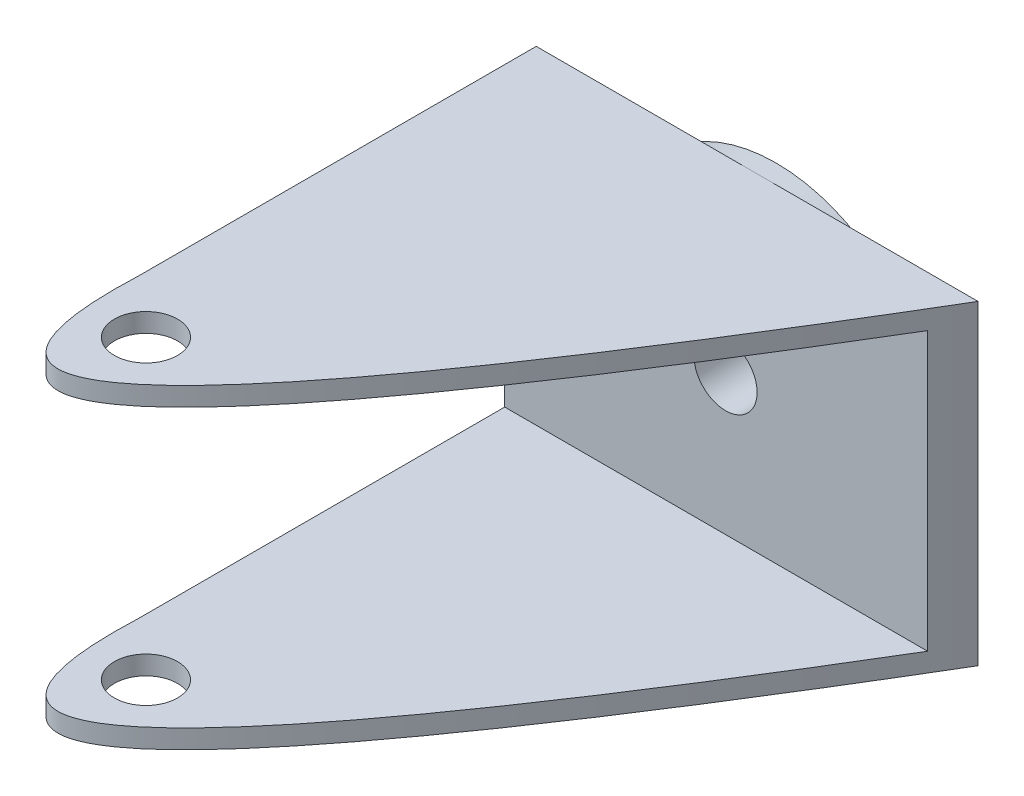
from build123d import *

# Parameters (mm, degrees)
EXTRUDE_1_DEPTH      = 50
SKETCH_2_R           = 4.999999999999998
CUT_EXTRUDE_1_DEPTH  = 98.87084830229739
SKETCH_3_R           = 15
EXTRUDE_2_DEPTH      = 3
CUT_EXTRUDE_3_REACH  = 108.899
SKETCH_5_R           = 5.000000000000001
SKETCH_6_R           = 5.0000000000000036
CUT_EXTRUDE_5_DEPTH  = 107.89919436089083
CUT_EXTRUDE_7_DEPTH  = 120.99999999999977
CUT_EXTRUDE_10_DEPTH = 10
SKETCH_9_R           = 25
SKETCH_9_R_2         = 15
EXTRUDE_3_DEPTH      = 3
SKETCH_10_R          = 5.0000000000000036
EXTRUDE_4_DEPTH      = 8
SKETCH_11_W          = 70
SKETCH_11_H          = 50.00000000000001
CUT_EXTRUDE_11_DEPTH = 8
SKETCH_12_R          = 25.000000000000004
EXTRUDE_6_DEPTH      = 3
CUT_EXTRUDE_14_DEPTH = 6.500000000000001
SCALE_1_SCALE        = 0.5
SCALE_2_SCALE        = 1.2


with BuildPart() as part:
    # 草图1 → 凸台-拉伸1 (new body)
    with BuildSketch(Plane(origin=(0, 0, 0), x_dir=(1, 0, 0), z_dir=(0, 1, 0))):
        with BuildLine():
            Line((-23.323422211177558, 7.232068902691513), (-23.323422211177558, 70))
            Line((-23.323422211177558, 70), (46.67657778882245, 70))
            add(Edge.make_bspline(
                [(46.67657778882245, 70), (-25.880344692728325, -52.054397164609135), (-23.323422211177558, 7.232068902691513)],
                knots=[0, 0, 0, 1, 1, 1], degree=2))
        make_face()
    extrude(amount=EXTRUDE_1_DEPTH)

    # 草图2 → 切除-拉伸1 (cut, through all)
    with BuildSketch(Plane(origin=(0, 50, 0), x_dir=(1, 0, 0), z_dir=(0, 1, 0))):
        with Locations(Location((-14.323422211177558, -0.8457019663808466, 0), (0, 0, 270))):
            Circle(SKETCH_2_R)
    extrude(amount=-CUT_EXTRUDE_1_DEPTH, mode=Mode.SUBTRACT)

    # 草图3 → 凸台-拉伸2 (add)
    with BuildSketch(Plane(origin=(0, 0, -70), x_dir=(-1, 0, 0), z_dir=(0, 0, -1))):
        with Locations(Location((-21.676577788822446, 25, 0), (0, 0, 180))):
            Circle(SKETCH_3_R)
    extrude(amount=EXTRUDE_2_DEPTH)

    # 草图5 → 切除-拉伸3 (cut, up to next)
    with BuildSketch(Plane(origin=(0, 0, -70), x_dir=(-1, 0, 0), z_dir=(0, 0, -1)), mode=Mode.PRIVATE) as cut_extrude_3_sk1:
        with Locations((-21.676577788822446, 25)):
            Circle(SKETCH_5_R)
    cut_extrude_3_tool1 = extrude(cut_extrude_3_sk1.sketch, amount=-CUT_EXTRUDE_3_REACH, mode=Mode.PRIVATE) & part.part
    add(cut_extrude_3_tool1.solids().sort_by_distance((21.676578, 25, -70))[0], mode=Mode.SUBTRACT)

    # 草图6 → 切除-拉伸5 (cut, through all)
    with BuildSketch(Plane.XY.offset(-70)):
        with Locations(Location((21.676577788822446, 25, 0), (0, 0, 180))):
            Circle(SKETCH_6_R)
    extrude(amount=-CUT_EXTRUDE_5_DEPTH, mode=Mode.SUBTRACT)

    # 草图7 → 切除-拉伸7 (cut)
    with BuildSketch(Plane.ZY.offset(23.323422211177558)):
        Polygon((-65.00000000000001, 47), (34.99999999999999, 47), (34.99999999999999, 3.0000000000000027), (-65.00000000000001, 3.0000000000000018), align=None)
    extrude(amount=-CUT_EXTRUDE_7_DEPTH, mode=Mode.SUBTRACT)

    # 草图8 → 切除-拉伸10 (cut)
    with BuildSketch(Plane(origin=(-23.323422211177558, 0, 0), x_dir=(0, 0, -1), z_dir=(1, 0, 0))):
        Polygon((7.232068902691513, 3.0000000000000027), (7.232068902691513, 47), (4.887844e-11, 47), (4.887757e-11, 3.000000000000002), align=None)
    extrude(amount=-CUT_EXTRUDE_10_DEPTH, mode=Mode.SUBTRACT)

    # 草图9 → 凸台-拉伸3 (add)
    with BuildSketch(Plane(origin=(0, 0, -70), x_dir=(-1, 0, 0), z_dir=(0, 0, -1))):
        with Locations(Location((-21.676577788822446, 25, 0), (0, 0, 180))):
            Circle(SKETCH_9_R)
        with Locations((-21.676577788822446, 25)):
            Circle(SKETCH_9_R_2, mode=Mode.SUBTRACT)
    extrude(amount=EXTRUDE_3_DEPTH)

    # 草图10 → 凸台-拉伸4 (add)
    with BuildSketch(Plane(origin=(0, 0, -73.00000000000001), x_dir=(-1, 0, 0), z_dir=(0, 0, -1))):
        with Locations((-21.676577788822446, 25)):
            Circle(SKETCH_10_R)
    extrude(amount=-EXTRUDE_4_DEPTH)

    # 草图11 → 切除-拉伸11 (cut)
    with BuildSketch(Plane(origin=(0, 0, -70), x_dir=(-1, 0, 0), z_dir=(0, 0, -1))):
        with Locations((-11.676577788822447, 25.000000000000004)):
            Rectangle(SKETCH_11_W, SKETCH_11_H)
    extrude(amount=CUT_EXTRUDE_11_DEPTH, mode=Mode.SUBTRACT)

    # 草图12 → 凸台-拉伸6 (add)
    with BuildSketch(Plane(origin=(0, 0, -70), x_dir=(-1, 0, 0), z_dir=(0, 0, -1))):
        with Locations(Location((-11.676577788822453, 25.000000000000004, 0), (0, 0, 270))):
            Circle(SKETCH_12_R)
    extrude(amount=EXTRUDE_6_DEPTH)

    # 草图19 → 切除-拉伸14 (cut, symmetric)
    with BuildSketch(Plane(origin=(0, 0, -70), x_dir=(-1, 0, 0), z_dir=(0, 0, -1))):
        with BuildLine():
            ThreePointArc((-7.607910432788657, 27.906190968595336), (-11.676577788822362, 30.000000000000004), (-15.745245144856133, 27.90619096859546))
            Line((-15.745245144856124, 27.90619096859548), (-11.676577788822456, 25.000000000000004))
            Line((-11.676577788822442, 25), (-7.607910432788756, 27.90619096859549))
        make_face()
        with BuildLine():
            Line((-11.676577788822456, 25.000000000000004), (-15.745245144856124, 27.90619096859548))
            ThreePointArc((-15.745245144856133, 27.90619096859546), (-16.67657778882244, 25), (-15.745245144856128, 22.09380903140454))
            Line((-15.745245144856106, 22.093809031404525), (-11.676577788822442, 25))
        make_face()
        with BuildLine():
            Line((-7.607910432788756, 27.90619096859549), (-11.676577788822442, 25))
            Line((-11.676577788822456, 25.000000000000004), (-7.607910432788778, 22.09380903140452))
            ThreePointArc((-7.607910432788663, 22.09380903140466), (-6.915100246075392, 23.47411284496017), (-6.676577788822438, 25.000000000000004))
            ThreePointArc((-6.676577788822438, 25.000000000000004), (-6.915100246075391, 26.525887155039833), (-7.607910432788657, 27.906190968595336))
        make_face()
        with BuildLine():
            Line((-7.607910432788778, 22.09380903140452), (-11.676577788822456, 25.000000000000004))
            Line((-11.676577788822442, 25), (-15.745245144856106, 22.093809031404525))
            ThreePointArc((-15.745245144856128, 22.09380903140454), (-11.676577788822364, 20.000000000000004), (-7.607910432788663, 22.09380903140466))
        make_face()
    extrude(amount=CUT_EXTRUDE_14_DEPTH, both=True, mode=Mode.SUBTRACT)


with BuildPart() as part_1:
    # 缩放比例1: scaled about (6.493831083, 24.99994197, -53.778737611)
    add(part.part.scale(SCALE_1_SCALE).moved(Location((3.2469155415, 12.499970985, -26.8893688055))))


with BuildPart() as part_2:
    # 缩放比例2: scaled about (6.493831083, 24.99994197, -53.778737611)
    add(part_1.part.scale(SCALE_2_SCALE).moved(Location((-1.2987662165999998, -4.999988393999999, 10.755747522199997))))


solid = part_2.part
